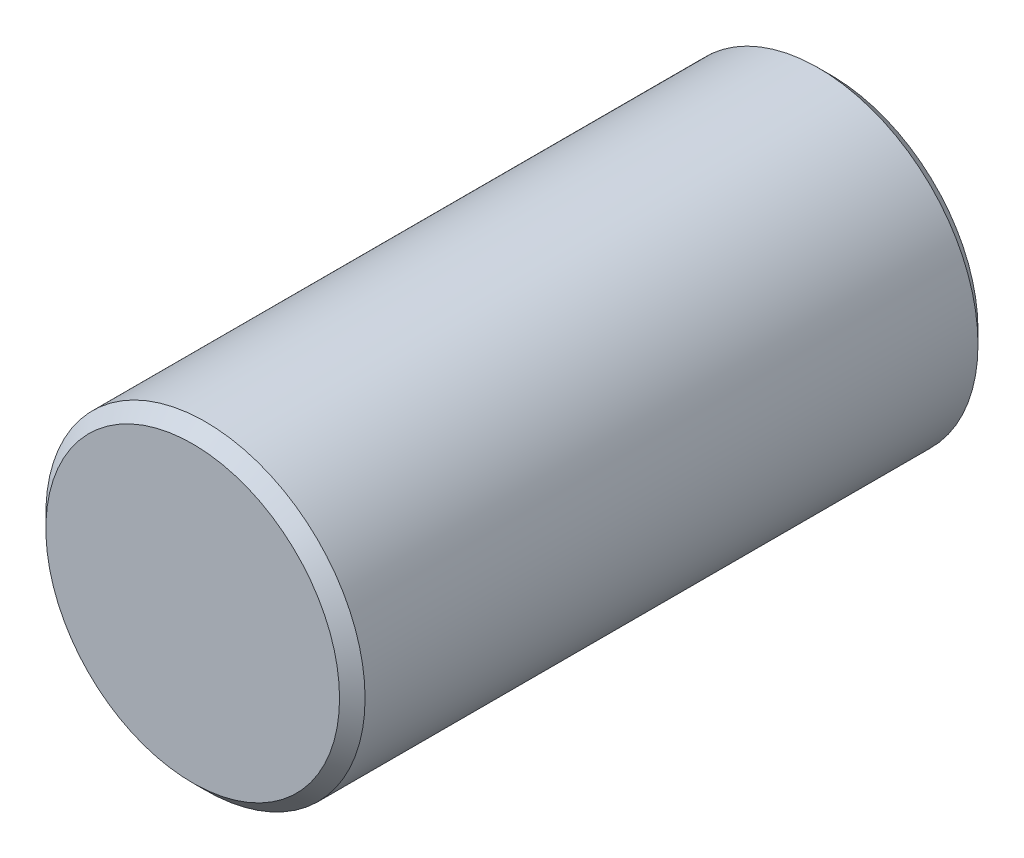
from build123d import *

# Parameters (mm, degrees)
SKETCH1_R           = 50
BOSS_EXTRUDE1_DEPTH = 200
CHAMFER1_SIZE       = 4
ECHELLE1_SCALE      = 0.075


with BuildPart() as part:
    # Sketch1 → Boss-Extrude1 (new body)
    with BuildSketch(Plane.XY):
        Circle(SKETCH1_R)
    extrude(amount=BOSS_EXTRUDE1_DEPTH)

    # Chamfer1
    chamfer1_edges = [part.edges().sort_by_distance(p)[0] for p in [
        (-50, 0, 0),
        (-50, 0, 200),
    ]]
    chamfer(chamfer1_edges, length=CHAMFER1_SIZE)


with BuildPart() as part_1:
    # Echelle1: scaled about (0, 0, 100)
    add(part.part.scale(ECHELLE1_SCALE).moved(Location((0, 0, 92.5))))


solid = part_1.part
